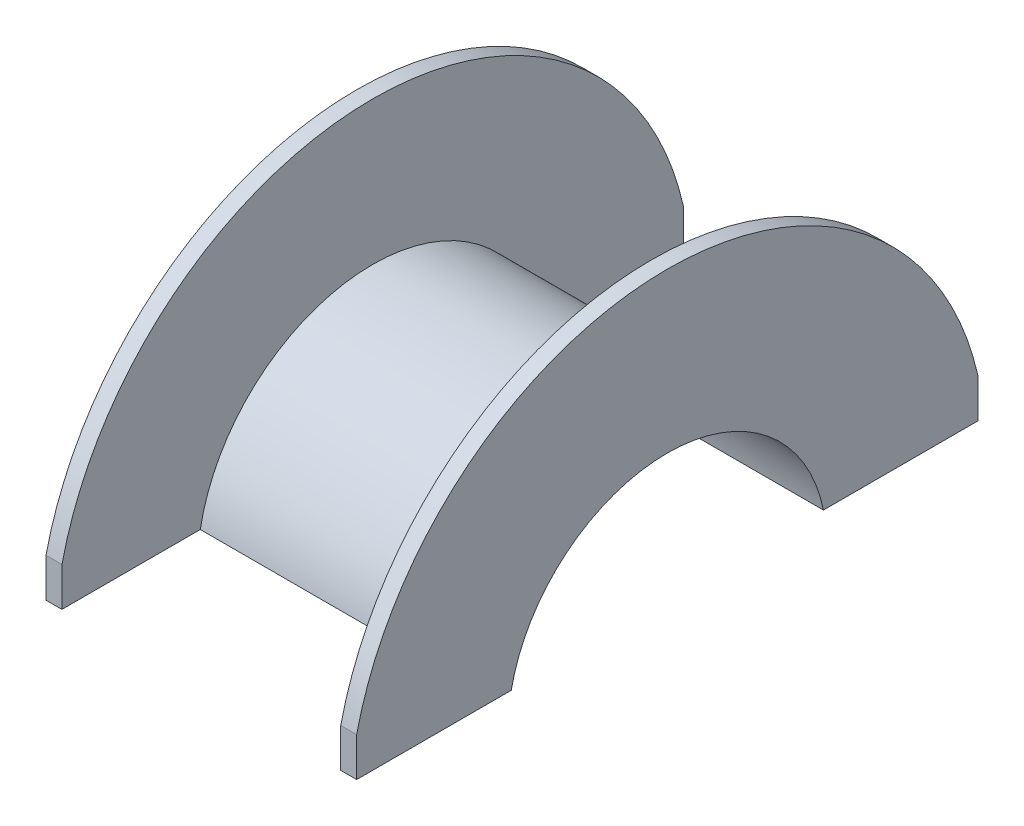
from build123d import *

# Parameters (mm, degrees)
SKETCH_2_W          = 51.075539497
SKETCH_2_H          = 30.123383878
CUT_EXTRUDE_1_DEPTH = 40
SKETCH_3_W          = 2.341501377
SKETCH_3_H          = 8.048910983
SKETCH_3_W_2        = 1.756126033
SKETCH_3_H_2        = 6.841574336
CUT_EXTRUDE_2_DEPTH = 20


with BuildPart() as part:
    # Эскиз1 → Повернуть1 (revolve)
    with BuildSketch(Plane.XY, mode=Mode.PRIVATE) as revolve_1_sk:
        Polygon((-9.75, 20), (-8.75, 20), (-8.75, 11), (8.75, 11), (8.75, 20), (9.75, 20), (9.75, 10), (-9.75, 10), align=None)
    revolve(revolve_1_sk.sketch.rotate(Axis((-17.336723769, 0, 0), (1, 0, 0)), 90), axis=Axis((-17.336723769, 0, 0), (1, 0, 0)))

    # Эскиз2 → Вырез-Вытянуть1 (cut)
    with BuildSketch(Plane(origin=(9.75, 0, 0), x_dir=(0, 0, -1), z_dir=(1, 0, 0))):
        with Locations((-1.37941238, -13.061691939)):
            Rectangle(SKETCH_2_W, SKETCH_2_H)
    extrude(amount=-CUT_EXTRUDE_1_DEPTH, mode=Mode.SUBTRACT)

    # Эскиз3 → Вырез-Вытянуть2 (cut)
    with BuildSketch(Plane(origin=(9.75, 0, 0), x_dir=(0, 0, -1), z_dir=(1, 0, 0))):
        with Locations((-20.670750689, 2.548643467)):
            Rectangle(SKETCH_3_W, SKETCH_3_H)
        with Locations((20.378063017, 2.310834734)):
            Rectangle(SKETCH_3_W_2, SKETCH_3_H_2)
    extrude(amount=-CUT_EXTRUDE_2_DEPTH, mode=Mode.SUBTRACT)


solid = part.part
